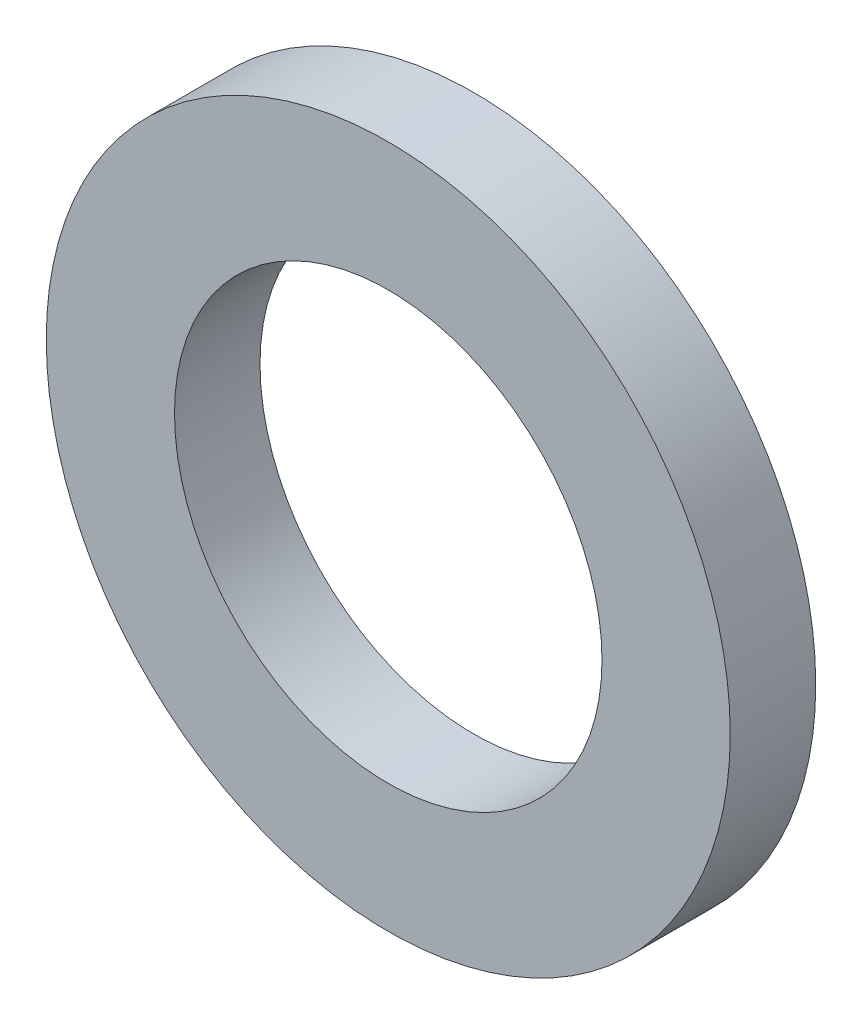
from build123d import *

# Parameters (mm, degrees)
SKETCH1_R           = 12.7
SKETCH1_R_2         = 7.9375
BOSS_EXTRUDE1_DEPTH = 3.175


with BuildPart() as part:
    # Sketch1 → Boss-Extrude1 (new body)
    with BuildSketch(Plane.XY):
        Circle(SKETCH1_R)
        Circle(SKETCH1_R_2, mode=Mode.SUBTRACT)
    extrude(amount=BOSS_EXTRUDE1_DEPTH)


solid = part.part
